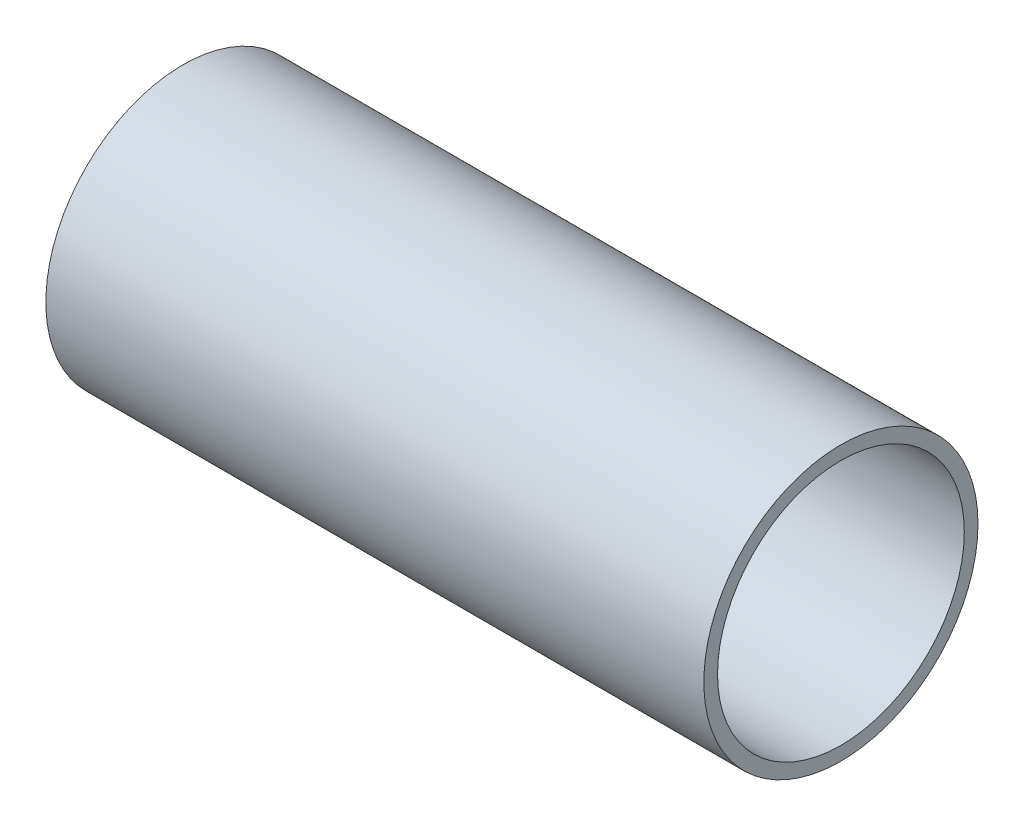
from build123d import *

# Parameters (mm, degrees)
SKETCH1_R      = 31.75
SKETCH1_R_2    = 28.575
EXTRUDE1_DEPTH = 152.4


with BuildPart() as part:
    # Sketch1 → Extrude1 (new body)
    with BuildSketch(Plane(origin=(0, 0, 0), x_dir=(0, 0, -1), z_dir=(1, 0, 0))):
        Circle(SKETCH1_R)
        Circle(SKETCH1_R_2, mode=Mode.SUBTRACT)
    extrude(amount=-EXTRUDE1_DEPTH)


solid = part.part
